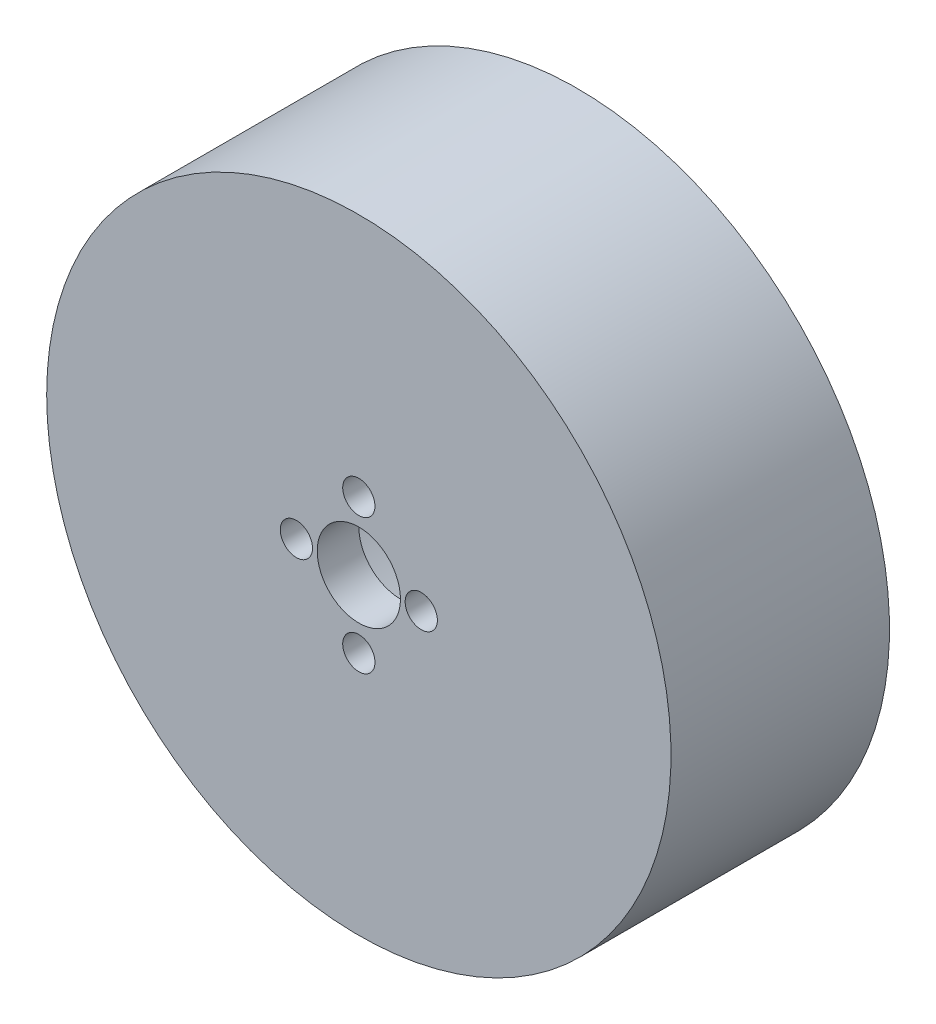
from build123d import *

# Parameters (mm, degrees)
SKETCH1_R           = 30
BOSS_EXTRUDE1_DEPTH = 10.5
SKETCH2_R           = 1.55
SKETCH2_R_2         = 4
CUT_EXTRUDE1_DEPTH  = 10
SKETCH3_R           = 21
CUT_EXTRUDE2_DEPTH  = 17


with BuildPart() as part:
    # Sketch1 → Boss-Extrude1 (new, symmetric)
    with BuildSketch(Plane.XY):
        with Locations(Location((0, 0, 0), (0, 0, 180))):
            Circle(SKETCH1_R)
    extrude(amount=BOSS_EXTRUDE1_DEPTH, both=True)

    # Sketch2 → Cut-Extrude1 (cut)
    with BuildSketch(Plane.XY.offset(10.5)):
        with Locations((-6, 0)):
            Circle(SKETCH2_R)
        with Locations((0, 6.5)):
            Circle(SKETCH2_R)
        with Locations((6, 0)):
            Circle(SKETCH2_R)
        with Locations((0, -6.5)):
            Circle(SKETCH2_R)
        Circle(SKETCH2_R_2)
    extrude(amount=-CUT_EXTRUDE1_DEPTH, mode=Mode.SUBTRACT)

    # Sketch3 → Cut-Extrude2 (cut)
    with BuildSketch(Plane(origin=(0, 0, -10.5), x_dir=(-1, 0, 0), z_dir=(0, 0, -1))):
        Circle(SKETCH3_R)
    extrude(amount=-CUT_EXTRUDE2_DEPTH, mode=Mode.SUBTRACT)


solid = part.part
